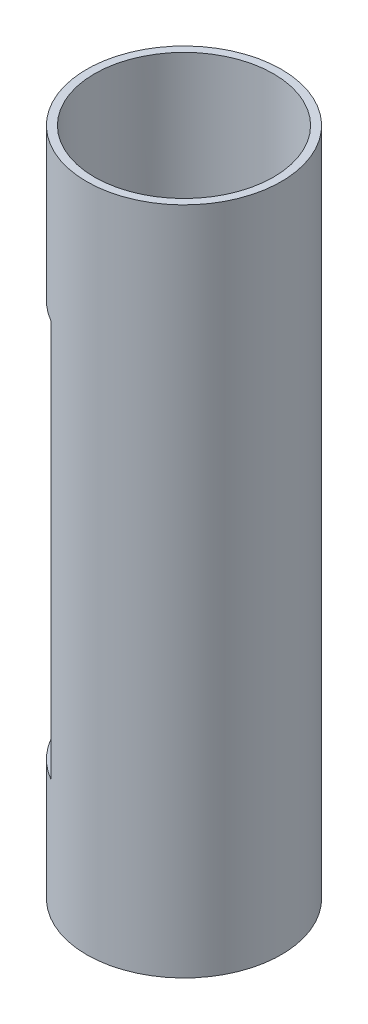
from build123d import *

# Parameters (mm, degrees)
SKETCH_1_R          = 25
SKETCH_1_R_2        = 23
EXTRUDE_1_DEPTH     = 172
CUT_EXTRUDE_1_DEPTH = 102


with BuildPart() as part:
    # Эскиз1 → Бобышка-Вытянуть1 (new body)
    with BuildSketch(Plane(origin=(0, 0, 0), x_dir=(1, 0, 0), z_dir=(0, 1, 0))):
        with Locations(Location((0, 0, 0), (0, 0, 270))):
            Circle(SKETCH_1_R)
        with Locations(Location((0, 0, 0), (0, 0, 270))):
            Circle(SKETCH_1_R_2, mode=Mode.SUBTRACT)
    extrude(amount=EXTRUDE_1_DEPTH)

    # Эскиз2 → Вырез-Вытянуть1 (cut)
    with BuildSketch(Plane(origin=(0, 31, 0), x_dir=(-1, 0, 0), z_dir=(0, -1, 0))):
        Polygon((0, 0), (29.61457633, 51.293950849), (33.452789958, -57.941931861), align=None)
    extrude(amount=-CUT_EXTRUDE_1_DEPTH, mode=Mode.SUBTRACT)


solid = part.part
